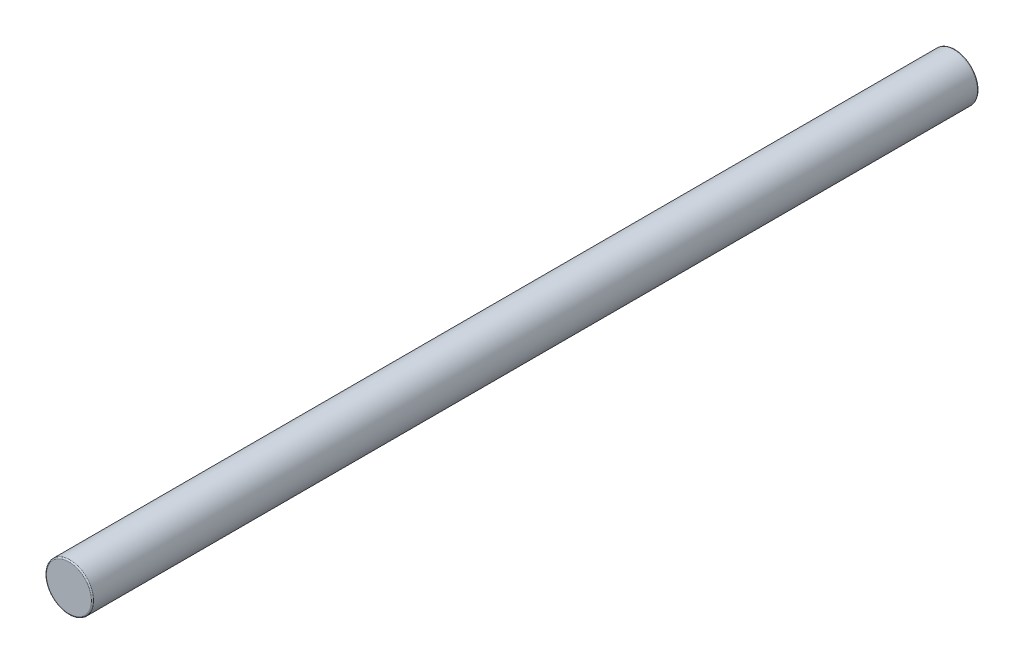
from build123d import *

# Parameters (mm, degrees)
SKETCH1_R           = 4
BOSS_EXTRUDE1_DEPTH = 150
FILLET1_R           = 0.2


with BuildPart() as part:
    # Sketch1 → Boss-Extrude1 (new body)
    with BuildSketch(Plane.XY):
        Circle(SKETCH1_R)
    extrude(amount=-BOSS_EXTRUDE1_DEPTH)

    # Fillet1
    fillet1_edges = [part.edges().sort_by_distance(p)[0] for p in [
        (-4, 0, 0),
        (-4, 0, -150),
    ]]
    fillet(fillet1_edges, radius=FILLET1_R)


solid = part.part
